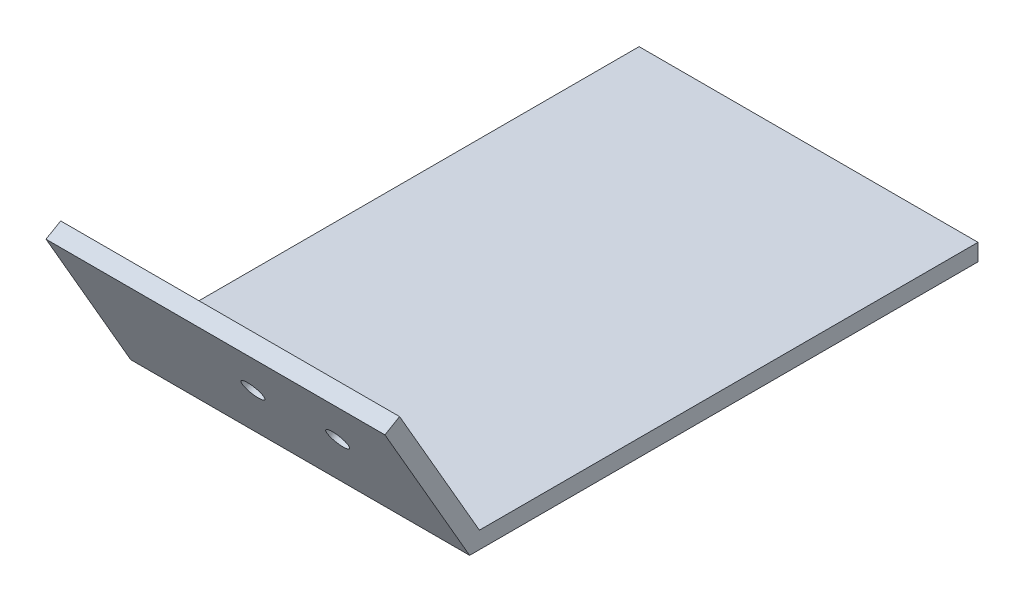
from build123d import *

# Parameters (mm, degrees)
BOSS_EXTRUDE1_DEPTH = 100
SKETCH2_R           = 3.175
CUT_EXTRUDE1_DEPTH  = 182.919520377


with BuildPart() as part:
    # Sketch1 → Boss-Extrude1 (new body)
    with BuildSketch(Plane(origin=(0, 0, 0), x_dir=(0, 0, -1), z_dir=(1, 0, 0))):
        Polygon((0, 0), (-25, 43.301270189), (-20.669872981, 45.801270189), (2.886751346, 5), (150, 5), (150, 0), align=None)
    extrude(amount=BOSS_EXTRUDE1_DEPTH)

    # Sketch2 → Cut-Extrude1 (cut, through all)
    with BuildSketch(Plane(origin=(0, 2.5, -4.330127019), x_dir=(-1, 0, 0), z_dir=(0, 0.49999999999999806, -0.8660254037844397))):
        with Locations(Location((-75, 27.886751346, 0), (0, 0, 90))):
            Circle(SKETCH2_R)
        with Locations(Location((-50, 27.886751346, 0), (0, 0, 90))):
            Circle(SKETCH2_R)
    extrude(amount=-CUT_EXTRUDE1_DEPTH, mode=Mode.SUBTRACT)


solid = part.part
